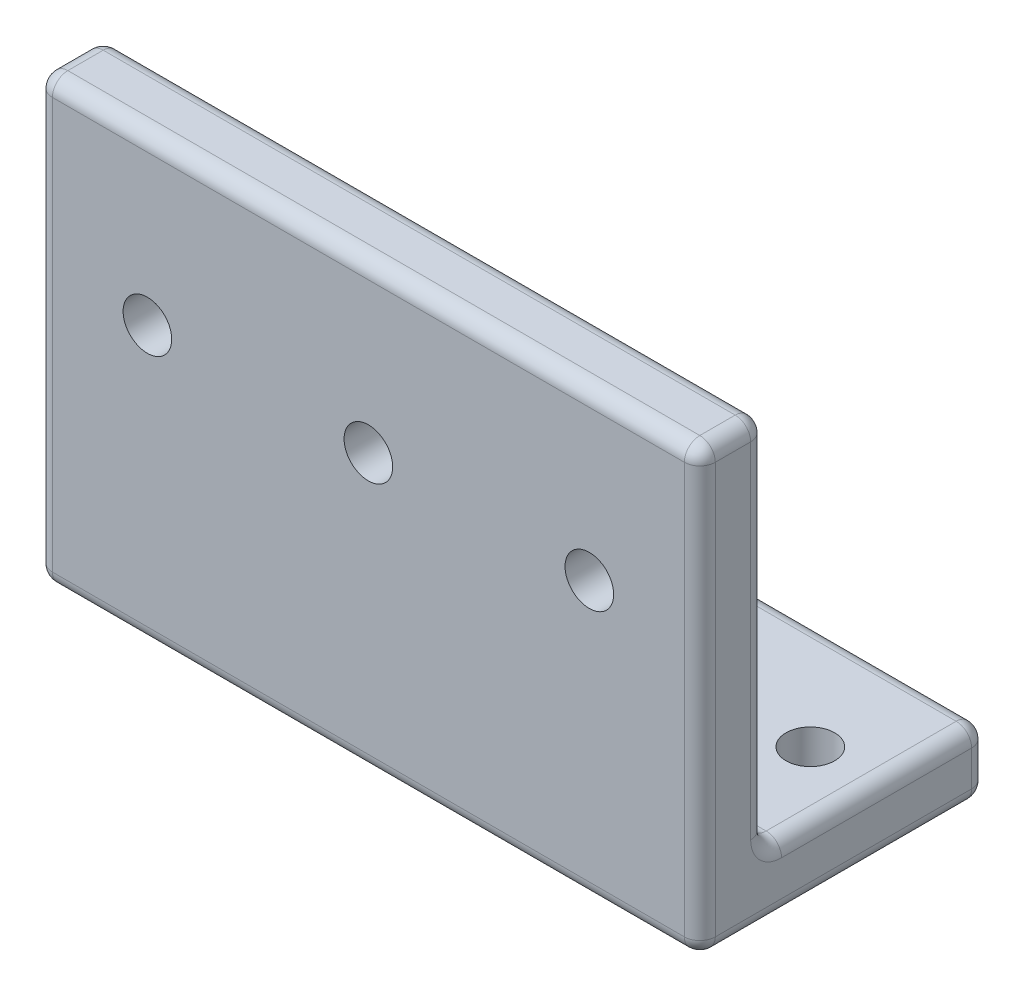
from build123d import *

# Parameters (mm, degrees)
SKETCH_1_W              = 16
SKETCH_1_H              = 3
EXTRUDE_1_DEPTH         = 10
SKETCH_2_W              = 30
SKETCH_2_H              = 20
EXTRUDE_2_DEPTH         = 3
HOLE_WIZARD_2_2_2_2_1_D = 2.2
HOLE_WIZARD_2_2_2_2_2_D = 2.2
FILLET_1_R              = 0.7


with BuildPart() as part:
    # 草图1 → 凸台-拉伸1 (new body)
    with BuildSketch(Plane.XY):
        with Locations((0, 1.5)):
            Rectangle(SKETCH_1_W, SKETCH_1_H)
    extrude(amount=-EXTRUDE_1_DEPTH)

    # 草图2 → 凸台-拉伸2 (add)
    with BuildSketch(Plane.XY):
        with Locations((-7, 10)):
            Rectangle(SKETCH_2_W, SKETCH_2_H)
    extrude(amount=EXTRUDE_2_DEPTH)

    # Ø2.2 (2.2) 直径孔1 (through all)
    with Locations(Plane(origin=(0, 3, 0), x_dir=(1, 0, 0), z_dir=(0, 1, 0))):
        with Locations((-5, 5), (5, 5)):
            Hole(HOLE_WIZARD_2_2_2_2_1_D / 2)

    # Ø2.2 (2.2) 直径孔2 (through all)
    with Locations(Plane.XY.offset(3)):
        with Locations((-17, 12.52), (-7, 12.52), (3, 12.52)):
            Hole(HOLE_WIZARD_2_2_2_2_2_D / 2)

    # 圆角1
    fillet_1_edges = [part.edges().sort_by_distance(p)[0] for p in [
        (8, 1.5, -10),
        (8, 11.5, 0),
        (-7, 20, 0),
        (8, 20, 1.5),
        (-22, 10, 0),
        (-22, 20, 1.5),
        (-15, 0, 0),
        (-22, 0, 1.5),
        (8, 10, 3),
        (-7, 20, 3),
        (0, 3, -10),
        (-22, 10, 3),
        (-7, 0, 3),
        (-8, 1.5, -10),
        (0, 3, 0),
        (-8, 1.5, 0),
        (-8, 3, -5),
        (8, 3, -5),
        (8, 0, -3.5),
        (-8, 0, -5),
        (0, 0, -10),
    ]]
    fillet(fillet_1_edges, radius=FILLET_1_R)


solid = part.part
